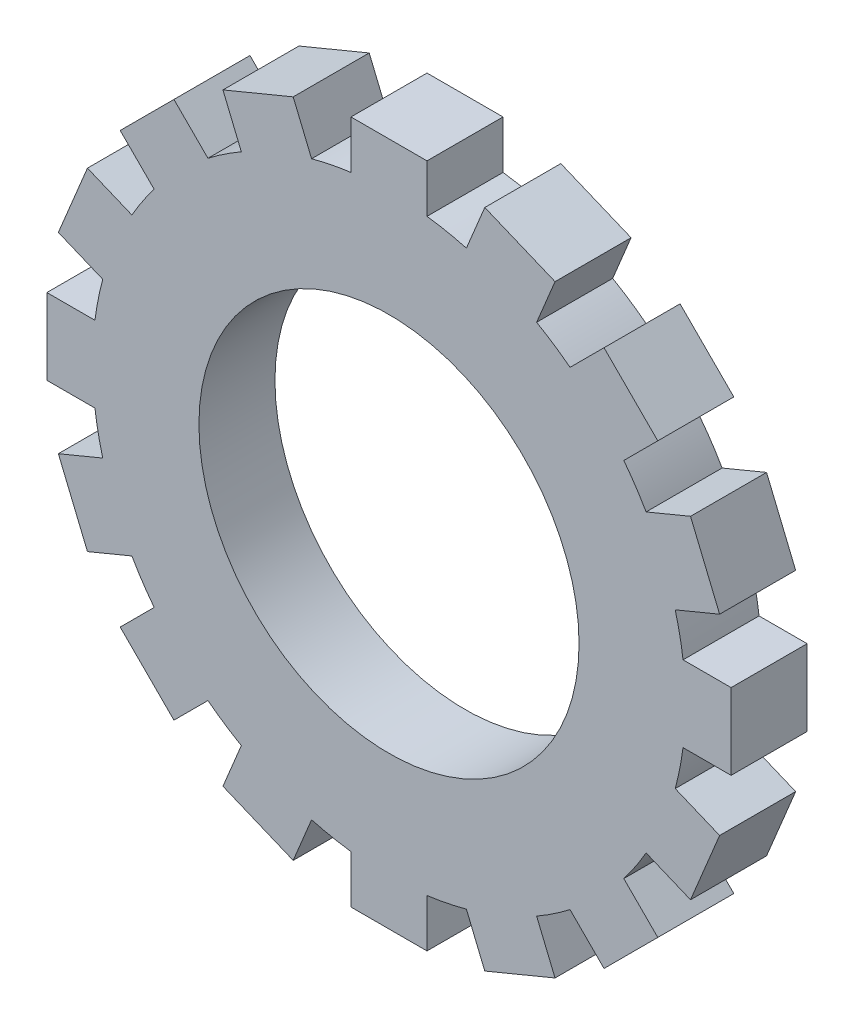
from build123d import *

# Parameters (mm, degrees)
IZIM1_R                     = 25
Y_KSEKLIK_EKSTR_ZYON2_DEPTH = 10


with BuildPart() as part:
    # Çizim1 → Yükseklik-Ekstrüzyon2 (new body)
    with BuildSketch(Plane.XY):
        with BuildLine():
            Line((43.487996125, -12.601356794), (39.661161801, -21.840152119))
            Line((39.661161801, -21.840152119), (33.820542489, -19.420888387))
            ThreePointArc((33.820542489, -19.420888387), (32.42731488, -21.667239088), (30.885122568, -23.814054756))
            Line((30.885122568, -23.814054756), (35.355339059, -28.284271247))
            Line((35.355339059, -28.284271247), (28.284271247, -35.355339059))
            Line((28.284271247, -35.355339059), (23.814054756, -30.885122568))
            ThreePointArc((23.814054756, -30.885122568), (21.667239088, -32.42731488), (19.420888387, -33.820542489))
            Line((19.420888387, -33.820542489), (21.840152119, -39.661161801))
            Line((21.840152119, -39.661161801), (12.601356794, -43.487996125))
            Line((12.601356794, -43.487996125), (10.182093062, -37.647376813))
            ThreePointArc((10.182093062, -37.647376813), (7.608522559, -38.250625936), (5, -38.678159212))
            Line((5, -38.678159212), (5, -45))
            Line((5, -45), (-5, -45))
            Line((-5, -45), (-5, -38.678159212))
            ThreePointArc((-5, -38.678159212), (-7.608522559, -38.250625936), (-10.182093062, -37.647376813))
            Line((-10.182093062, -37.647376813), (-12.601356794, -43.487996125))
            Line((-12.601356794, -43.487996125), (-21.840152119, -39.661161801))
            Line((-21.840152119, -39.661161801), (-19.420888387, -33.820542489))
            ThreePointArc((-19.420888387, -33.820542489), (-21.667239088, -32.42731488), (-23.814054756, -30.885122568))
            Line((-23.814054756, -30.885122568), (-28.284271247, -35.355339059))
            Line((-28.284271247, -35.355339059), (-35.355339059, -28.284271247))
            Line((-35.355339059, -28.284271247), (-30.885122568, -23.814054756))
            ThreePointArc((-30.885122568, -23.814054756), (-32.42731488, -21.667239088), (-33.820542489, -19.420888387))
            Line((-33.820542489, -19.420888387), (-39.661161801, -21.840152119))
            Line((-39.661161801, -21.840152119), (-43.487996125, -12.601356794))
            Line((-43.487996125, -12.601356794), (-37.647376813, -10.182093062))
            ThreePointArc((-37.647376813, -10.182093062), (-38.250625936, -7.608522559), (-38.678159212, -5))
            Line((-38.678159212, -5), (-45, -5))
            Line((-45, -5), (-45, 5))
            Line((-45, 5), (-38.678159212, 5))
            ThreePointArc((-38.678159212, 5), (-38.250625936, 7.608522559), (-37.647376813, 10.182093062))
            Line((-37.647376813, 10.182093062), (-43.487996125, 12.601356794))
            Line((-43.487996125, 12.601356794), (-39.661161801, 21.840152119))
            Line((-39.661161801, 21.840152119), (-33.820542489, 19.420888387))
            ThreePointArc((-33.820542489, 19.420888387), (-32.42731488, 21.667239088), (-30.885122568, 23.814054756))
            Line((-30.885122568, 23.814054756), (-35.355339059, 28.284271247))
            Line((-35.355339059, 28.284271247), (-28.284271247, 35.355339059))
            Line((-28.284271247, 35.355339059), (-23.814054756, 30.885122568))
            ThreePointArc((-23.814054756, 30.885122568), (-21.667239088, 32.42731488), (-19.420888387, 33.820542489))
            Line((-19.420888387, 33.820542489), (-21.840152119, 39.661161801))
            Line((-21.840152119, 39.661161801), (-12.601356794, 43.487996125))
            Line((-12.601356794, 43.487996125), (-10.182093062, 37.647376813))
            ThreePointArc((-10.182093062, 37.647376813), (-7.608522559, 38.250625936), (-5, 38.678159212))
            Line((-5, 38.678159212), (-5, 45))
            Line((-5, 45), (5, 45))
            Line((5, 45), (5, 38.678159212))
            ThreePointArc((5, 38.678159212), (7.608522559, 38.250625936), (10.182093062, 37.647376813))
            Line((10.182093062, 37.647376813), (12.601356794, 43.487996125))
            Line((12.601356794, 43.487996125), (21.840152119, 39.661161801))
            Line((21.840152119, 39.661161801), (19.420888387, 33.820542489))
            ThreePointArc((19.420888387, 33.820542489), (21.667239088, 32.42731488), (23.814054756, 30.885122568))
            Line((23.814054756, 30.885122568), (28.284271247, 35.355339059))
            Line((28.284271247, 35.355339059), (35.355339059, 28.284271247))
            Line((35.355339059, 28.284271247), (30.885122568, 23.814054756))
            ThreePointArc((30.885122568, 23.814054756), (32.42731488, 21.667239088), (33.820542489, 19.420888387))
            Line((33.820542489, 19.420888387), (39.661161801, 21.840152119))
            Line((39.661161801, 21.840152119), (43.487996125, 12.601356794))
            Line((43.487996125, 12.601356794), (37.647376813, 10.182093062))
            ThreePointArc((37.647376813, 10.182093062), (38.250625936, 7.608522559), (38.678159212, 5))
            Line((38.678159212, 5), (45, 5))
            Line((45, 5), (45, -5))
            Line((45, -5), (38.678159212, -5))
            ThreePointArc((38.678159212, -5), (38.250625936, -7.608522559), (37.647376813, -10.182093062))
            Line((37.647376813, -10.182093062), (43.487996125, -12.601356794))
        make_face()
        Circle(IZIM1_R, mode=Mode.SUBTRACT)
    extrude(amount=Y_KSEKLIK_EKSTR_ZYON2_DEPTH)


solid = part.part
